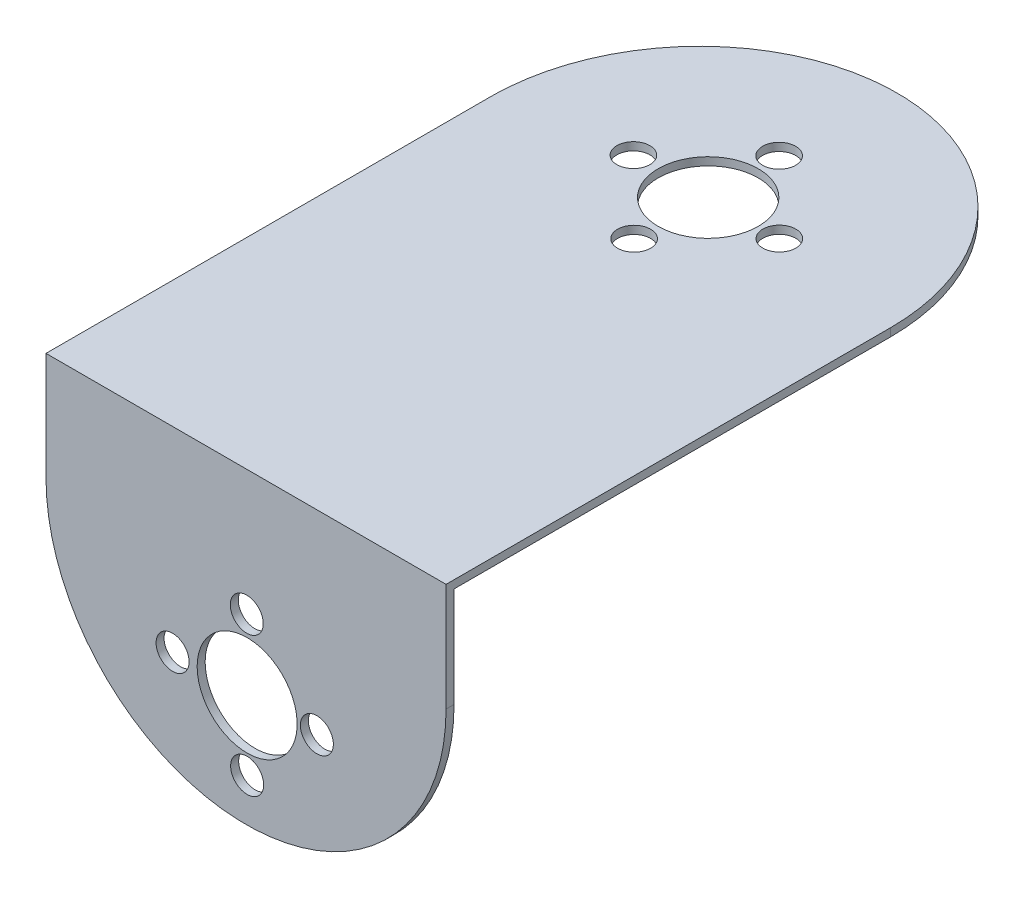
from build123d import *

# Parameters (mm, degrees)
SKETCH1_W           = 40
SKETCH1_H           = 60
BOSS_EXTRUDE1_DEPTH = 0.8
SKETCH2_RX          = 20.672864439
SKETCH2_RY          = 20
BOSS_EXTRUDE2_DEPTH = 0.8
SKETCH5_R           = 5
SKETCH5_R_2         = 1.65
CUT_EXTRUDE3_DEPTH  = 0.8
SKETCH6_W           = 40
SKETCH6_H           = 15.577429974
CUT_EXTRUDE4_DEPTH  = 10
SKETCH7_W           = 40
SKETCH7_H           = 0.8
BOSS_EXTRUDE3_DEPTH = 10
SKETCH8_R           = 20
BOSS_EXTRUDE4_DEPTH = 0.8
SKETCH9_W           = 37.719804767
SKETCH9_H           = 12.136565496
CUT_EXTRUDE5_DEPTH  = 0.8
SKETCH10_R          = 5
SKETCH10_R_2        = 1.65
CUT_EXTRUDE8_DEPTH  = 9.8


with BuildPart() as part:
    # Sketch1 → Boss-Extrude1 (new body)
    with BuildSketch(Plane(origin=(0, 0, 0), x_dir=(1, 0, 0), z_dir=(0, 1, 0))):
        with Locations((-29.928059701, 30.852985075)):
            Rectangle(SKETCH1_W, SKETCH1_H)
    extrude(amount=BOSS_EXTRUDE1_DEPTH)

    # Sketch2 → Boss-Extrude2 (add)
    with BuildSketch(Plane(origin=(0, 0.8, 0), x_dir=(1, 0, 0), z_dir=(0, 1, 0))):
        with Locations(Location((-29.928059701, 60.852985075), (0, 0, 90))):
            Ellipse(SKETCH2_RX, SKETCH2_RY)
    extrude(amount=-BOSS_EXTRUDE2_DEPTH)

    # Sketch5 → Cut-Extrude3 (cut)
    with BuildSketch(Plane(origin=(0, 0.8, 0), x_dir=(1, 0, 0), z_dir=(0, 1, 0))):
        with Locations(Location((-30.317199226, 63.029873106, 0), (0, 0, 270))):
            Circle(SKETCH5_R)
        with Locations(Location((-30.385900954, 70.192815662, 0), (0, 0, 270))):
            Circle(SKETCH5_R_2)
        with Locations(Location((-23.205910665, 63.029873106, 0), (0, 0, 270))):
            Circle(SKETCH5_R_2)
        with Locations(Location((-37.726365539, 62.961171378, 0), (0, 0, 270))):
            Circle(SKETCH5_R_2)
        with Locations(Location((-30.454602681, 55.758110249, 0), (0, 0, 270))):
            Circle(SKETCH5_R_2)
    extrude(amount=-CUT_EXTRUDE3_DEPTH, mode=Mode.SUBTRACT)

    # Sketch6 → Cut-Extrude4 (cut)
    with BuildSketch(Plane(origin=(0, 0, 0), x_dir=(-1, 0, 0), z_dir=(0, -1, 0))):
        with Locations((29.928059701, 8.641700062)):
            Rectangle(SKETCH6_W, SKETCH6_H)
    extrude(amount=-CUT_EXTRUDE4_DEPTH, mode=Mode.SUBTRACT)

    # Sketch7 → Boss-Extrude3 (add)
    with BuildSketch(Plane(origin=(0, 0, 0), x_dir=(-1, 0, 0), z_dir=(0, -1, 0))):
        with Locations((29.928059701, 16.830415049)):
            Rectangle(SKETCH7_W, SKETCH7_H)
    extrude(amount=BOSS_EXTRUDE3_DEPTH)

    # Sketch8 → Boss-Extrude4 (add)
    with BuildSketch(Plane(origin=(0, 0, -17.230415049), x_dir=(-1, 0, 0), z_dir=(0, 0, -1))):
        with Locations((29.928059701, -10)):
            Circle(SKETCH8_R)
    extrude(amount=-BOSS_EXTRUDE4_DEPTH)

    # Sketch9 → Cut-Extrude5 (cut)
    with BuildSketch(Plane(origin=(0, 0, -17.230415049), x_dir=(-1, 0, 0), z_dir=(0, 0, -1))):
        with Locations((31.954661755, 6.868282748)):
            Rectangle(SKETCH9_W, SKETCH9_H)
    extrude(amount=-CUT_EXTRUDE5_DEPTH, mode=Mode.SUBTRACT)

    # Sketch10 → Cut-Extrude8 (cut)
    with BuildSketch(Plane(origin=(0, 0, -17.230415049), x_dir=(-1, 0, 0), z_dir=(0, 0, -1))):
        with Locations((29.816238189, -18.756032874)):
            Circle(SKETCH10_R)
        with Locations((29.853512027, -11.748551436)):
            Circle(SKETCH10_R_2)
        with Locations((37.271005677, -18.756032874)):
            Circle(SKETCH10_R_2)
        with Locations((29.816238189, -25.688966638)):
            Circle(SKETCH10_R_2)
        with Locations((22.846030588, -18.681485199)):
            Circle(SKETCH10_R_2)
    extrude(amount=-CUT_EXTRUDE8_DEPTH, mode=Mode.SUBTRACT)


solid = part.part
